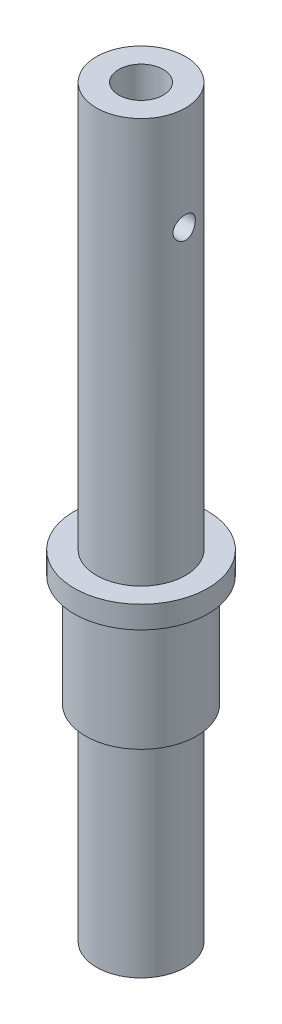
from build123d import *

# Parameters (mm, degrees)
SKETCH1_R                = 4
IMPELLER_SECTION_DEPTH   = 10.2921875
SKETCH2_R                = 2
IMPELLER_BOLT_BORE_DEPTH = 6.2921875
SEAL_START               = 26.0921875
SKETCH3_R                = 4
SEAL_SECTION_DEPTH       = 26.0921875
DOWEL_HOLE_DEPTH         = 10
DOWEL_HOLE_DEPTH_BACK    = 10
SKETCH5_R                = 1
SKETCH6_R                = 6
BEARING_STOP_DEPTH       = 2
SKETCH8_R                = 5
BEARING_SECTION_DEPTH    = 10
BOSS_EXTRUDE4_START      = 18.5
SKETCH9_R                = 4
BOSS_EXTRUDE4_DEPTH      = 18.5


with BuildPart() as part:
    # Sketch1 → impeller section (new body)
    with BuildSketch(Plane(origin=(0, 0, 0), x_dir=(1, 0, 0), z_dir=(0, 1, 0))):
        with Locations(Location((0, 0, 0), (0, 0, 270))):
            Circle(SKETCH1_R)
    extrude(amount=IMPELLER_SECTION_DEPTH)

    # Sketch2 → impeller bolt bore (cut)
    with BuildSketch(Plane(origin=(0, 10.2921875, 0), x_dir=(1, 0, 0), z_dir=(0, 1, 0))):
        with Locations(Location((0, 0, 0), (0, 0, 270))):
            Circle(SKETCH2_R)
    extrude(amount=-IMPELLER_BOLT_BORE_DEPTH, mode=Mode.SUBTRACT)

    # Sketch3 → seal section (add)
    with BuildSketch(Plane(origin=(0, 0, 0), x_dir=(-1, 0, 0), z_dir=(0, -1, 0)).offset(SEAL_START)):
        with Locations(Location((0, 0, 0), (0, 0, 90))):
            Circle(SKETCH3_R)
    extrude(amount=-SEAL_SECTION_DEPTH)

    # Sketch5 → dowel hole (cut, two sides: drawn at the far end of the back side and taken through both)
    with BuildSketch(Plane(origin=(0, 0, 0), x_dir=(0, 0, -1), z_dir=(1, 0, 0)).offset(-DOWEL_HOLE_DEPTH_BACK)):
        with Locations(Location((0, 1, 0), (0, 0, 180))):
            Circle(SKETCH5_R)
    extrude(amount=DOWEL_HOLE_DEPTH + DOWEL_HOLE_DEPTH_BACK, mode=Mode.SUBTRACT)

    # Sketch6 → bearing stop (add)
    with BuildSketch(Plane.XZ.offset(26.0921875)):
        with Locations(Location((0, 0, 0), (0, 0, 270))):
            Circle(SKETCH6_R)
    extrude(amount=BEARING_STOP_DEPTH)

    # Sketch8 → bearing section (add)
    with BuildSketch(Plane.XZ.offset(28.0921875)):
        with Locations(Location((0, 0, 0), (0, 0, 270))):
            Circle(SKETCH8_R)
    extrude(amount=BEARING_SECTION_DEPTH)

    # Sketch9 → Boss-Extrude4 (add)
    with BuildSketch(Plane(origin=(0, -38.0921875, 0), x_dir=(-1, 0, 0), z_dir=(0, -1, 0)).offset(BOSS_EXTRUDE4_START)):
        with Locations(Location((0, 0, 0), (0, 0, 90))):
            Circle(SKETCH9_R)
    extrude(amount=-BOSS_EXTRUDE4_DEPTH)


solid = part.part
